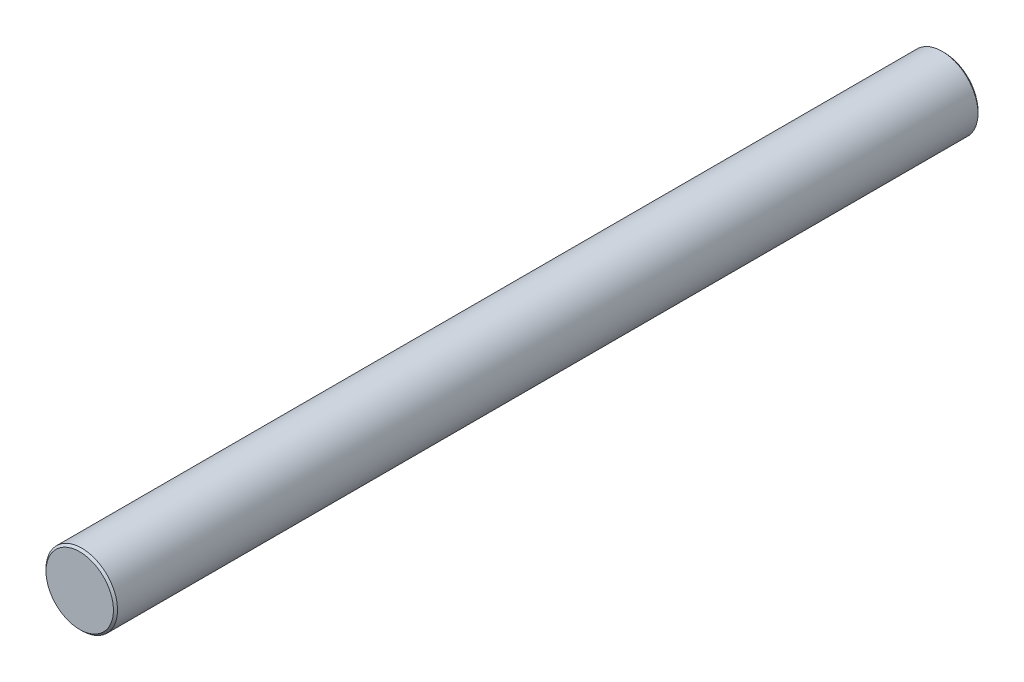
from build123d import *

# Parameters (mm, degrees)
SKETCH1_R           = 3.475
BOSS_EXTRUDE1_DEPTH = 42
CHAMFER1_SIZE       = 0.2


with BuildPart() as part:
    # Sketch1 → Boss-Extrude1 (new, symmetric)
    with BuildSketch(Plane.XY):
        with Locations(Location((0, 0, 0), (0, 0, 180))):
            Circle(SKETCH1_R)
    extrude(amount=BOSS_EXTRUDE1_DEPTH, both=True)

    # Chamfer1
    chamfer1_edges = [part.edges().sort_by_distance(p)[0] for p in [
        (3.475, 0, -42),
        (3.475, 0, 42),
    ]]
    chamfer(chamfer1_edges, length=CHAMFER1_SIZE)


solid = part.part
